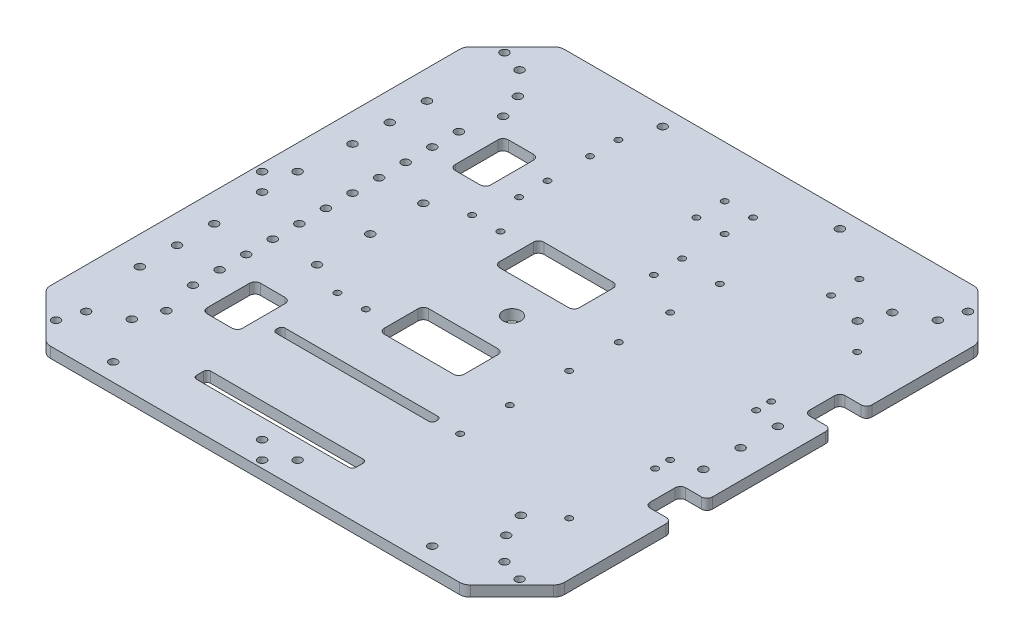
from build123d import *

# Parameters (mm, degrees)
BOSS_EXTRU_1_DEPTH         = 6
ENL_V_MAT_EXTRU_21_REACH   = 214.217
ESQUISSE22_R               = 5
ENL_V_MAT_EXTRU_22_REACH   = 214.217
ESQUISSE23_R               = 2.3
SYM_TRIE15_COPY_1_REACH    = 214.217
SYM_TRIE15_COPY_1_SKETCH_R = 2.3
ENL_V_MAT_EXTRU_23_REACH   = 214.217
CONG_8_R                   = 6
ENL_V_MAT_EXTRU_24_REACH   = 207.149
ESQUISSE27_R               = 2.3
ENL_V_MAT_EXTRU_25_REACH   = 207.149
ESQUISSE28_R               = 2.3
ENL_V_MAT_EXTRU_26_REACH   = 207.149
ESQUISSE29_R               = 2.3
ENL_V_MAT_EXTRU_27_REACH   = 207.149
ESQUISSE30_R               = 2.3
ENL_V_MAT_EXTRU_28_REACH   = 207.149
ESQUISSE32_R               = 2.3
ENL_V_MAT_EXTRU_29_REACH   = 207.149
ESQUISSE33_R               = 2.3
ENL_V_MAT_EXTRU_30_REACH   = 207.149
ESQUISSE39_R               = 2.3
ENL_V_MAT_EXTRU_31_REACH   = 207.149
ESQUISSE38_R               = 1.8
ENL_V_MAT_EXTRU_32_REACH   = 207.149
CONG_9_R                   = 2
ENL_V_MAT_EXTRU_33_REACH   = 207.149
ESQUISSE44_W               = 45
ESQUISSE44_H               = 25
ENL_V_MAT_EXTRU_34_REACH   = 207.149
ESQUISSE45_W               = 15
ESQUISSE45_H               = 20
ENL_V_MAT_EXTRU_35_REACH   = 207.149
ESQUISSE46_R               = 1.8
ENL_V_MAT_EXTRU_36_REACH   = 207.149
ESQUISSE43_R               = 2.3
ENL_V_MAT_EXTRU_37_REACH   = 207.149
ESQUISSE47_W               = 20
ESQUISSE47_H               = 30
CONG_10_R                  = 3


with BuildPart() as part:
    # Esquisse1 → Boss.-Extru.1 (new body)
    with BuildSketch(Plane(origin=(0, 0, 0), x_dir=(1, 0, 0), z_dir=(0, 1, 0))):
        Polygon((-150, 0), (-150, 120), (-120, 150), (0, 150), (120, 150), (150, 120), (150, 0), (150, -120), (120, -150), (0, -150), (-120, -150), (-150, -120), align=None)
    extrude(amount=BOSS_EXTRU_1_DEPTH)

    # Esquisse22 → Enlèv. mat.-Extru.21 (cut, up to next)
    with BuildSketch(Plane(origin=(0, 6, 0), x_dir=(1, 0, 0), z_dir=(0, 1, 0)), mode=Mode.PRIVATE) as enl_v_mat_extru_21_sk1:
        Circle(ESQUISSE22_R)
    enl_v_mat_extru_21_tool1 = extrude(enl_v_mat_extru_21_sk1.sketch, amount=-ENL_V_MAT_EXTRU_21_REACH, mode=Mode.PRIVATE) & part.part
    add(enl_v_mat_extru_21_tool1.solids().sort_by_distance((0, 6, 0))[0], mode=Mode.SUBTRACT)

    # Esquisse23 → Enlèv. mat.-Extru.22 (cut, up to next)
    with BuildSketch(Plane(origin=(0, 6, 0), x_dir=(1, 0, 0), z_dir=(0, 1, 0)), mode=Mode.PRIVATE) as enl_v_mat_extru_22_sk1:
        with Locations((-100, 95)):
            Circle(ESQUISSE23_R)
    enl_v_mat_extru_22_tool1 = extrude(enl_v_mat_extru_22_sk1.sketch, amount=-ENL_V_MAT_EXTRU_22_REACH, mode=Mode.PRIVATE) & part.part
    # Esquisse23 → Enlèv. mat.-Extru.22 (cut, up to next)
    with BuildSketch(Plane(origin=(0, 6, 0), x_dir=(1, 0, 0), z_dir=(0, 1, 0)), mode=Mode.PRIVATE) as enl_v_mat_extru_22_sk2:
        with Locations((-105.619098901, 108.907757819)):
            Circle(ESQUISSE23_R)
    enl_v_mat_extru_22_tool2 = extrude(enl_v_mat_extru_22_sk2.sketch, amount=-ENL_V_MAT_EXTRU_22_REACH, mode=Mode.PRIVATE) & part.part
    enl_v_mat_extru_22_1 = enl_v_mat_extru_22_tool1.solids().sort_by_distance((-100, 6, -95))[0]
    add(enl_v_mat_extru_22_1, mode=Mode.SUBTRACT)
    enl_v_mat_extru_22_2 = enl_v_mat_extru_22_tool2.solids().sort_by_distance((-105.619099, 6, -108.907758))[0]
    add(enl_v_mat_extru_22_2, mode=Mode.SUBTRACT)
    enl_v_mat_extru_22 = enl_v_mat_extru_22_1 + enl_v_mat_extru_22_2  # Enlèv. mat.-Extru.22 as one shape, for the pattern or mirror that repeats it

    # Symétrie14: Enlèv. mat.-Extru.22 across plane
    add(enl_v_mat_extru_22.mirror(Plane(origin=(0, 0, 0), x_dir=(0, 0, 1), z_dir=(1, 0, 0))), mode=Mode.SUBTRACT)

    # Symétrie15: Enlèv. mat.-Extru.22 across plane
    add(enl_v_mat_extru_22.mirror(Plane.XY), mode=Mode.SUBTRACT)

    # Symétrie15 copy 1 sketch → Symétrie15 copy 1 (cut, up to next)
    with BuildSketch(Plane(origin=(0, 6, 0), x_dir=(-1, 0, 0), z_dir=(0, 1, 0)), mode=Mode.PRIVATE) as sym_trie15_copy_1_sk1:
        with Locations((-100, 95)):
            Circle(SYM_TRIE15_COPY_1_SKETCH_R)
    sym_trie15_copy_1_tool1 = extrude(sym_trie15_copy_1_sk1.sketch, amount=-SYM_TRIE15_COPY_1_REACH, mode=Mode.PRIVATE) & part.part
    # Symétrie15 copy 1 sketch → Symétrie15 copy 1 (cut, up to next)
    with BuildSketch(Plane(origin=(0, 6, 0), x_dir=(-1, 0, 0), z_dir=(0, 1, 0)), mode=Mode.PRIVATE) as sym_trie15_copy_1_sk2:
        with Locations((-105.619098901, 108.907757819)):
            Circle(SYM_TRIE15_COPY_1_SKETCH_R)
    sym_trie15_copy_1_tool2 = extrude(sym_trie15_copy_1_sk2.sketch, amount=-SYM_TRIE15_COPY_1_REACH, mode=Mode.PRIVATE) & part.part
    add(sym_trie15_copy_1_tool1.solids().sort_by_distance((100, 6, 95))[0], mode=Mode.SUBTRACT)
    add(sym_trie15_copy_1_tool2.solids().sort_by_distance((105.619099, 6, 108.907758))[0], mode=Mode.SUBTRACT)

    # Esquisse25 → Enlèv. mat.-Extru.23 (cut, up to next)
    with BuildSketch(Plane(origin=(0, 6, 0), x_dir=(1, 0, 0), z_dir=(0, 1, 0)), mode=Mode.PRIVATE) as enl_v_mat_extru_23_sk1:
        Polygon((-150, -120), (-120, -150), (120, -150), (150, -120), (150, 120), (120, 150), (-120, 150), (-150, 120), align=None)
        Polygon((-145, -117.928932188), (-145, 117.928932188), (-117.928932188, 145), (117.928932188, 145), (145, 117.928932188), (145, -117.928932188), (117.928932188, -145), (-117.928932188, -145), align=None, mode=Mode.SUBTRACT)
    enl_v_mat_extru_23_tool1 = extrude(enl_v_mat_extru_23_sk1.sketch, amount=-ENL_V_MAT_EXTRU_23_REACH, mode=Mode.PRIVATE) & part.part
    add(enl_v_mat_extru_23_tool1.solids().sort_by_distance((-132, 6, 132))[0], mode=Mode.SUBTRACT)

    # Congé8
    cong_8_edges = [part.edges().sort_by_distance(p)[0] for p in [
        (-117.928932188, 3, -145),
        (-145, 3, -117.928932188),
        (117.928932188, 3, -145),
        (145, 3, -117.928932188),
        (145, 3, 117.928932188),
        (117.928932188, 3, 145),
        (-145, 3, 117.928932188),
        (-117.928932188, 3, 145),
    ]]
    fillet(cong_8_edges, radius=CONG_8_R)

    # Esquisse27 → Enlèv. mat.-Extru.24 (cut, up to next)
    with BuildSketch(Plane(origin=(0, 6, 0), x_dir=(1, 0, 0), z_dir=(0, 1, 0)), mode=Mode.PRIVATE) as enl_v_mat_extru_24_sk1:
        with Locations((-141, 0)):
            Circle(ESQUISSE27_R)
    enl_v_mat_extru_24_tool1 = extrude(enl_v_mat_extru_24_sk1.sketch, amount=-ENL_V_MAT_EXTRU_24_REACH, mode=Mode.PRIVATE) & part.part
    # Esquisse27 → Enlèv. mat.-Extru.24 (cut, up to next)
    with BuildSketch(Plane(origin=(0, 6, 0), x_dir=(1, 0, 0), z_dir=(0, 1, 0)), mode=Mode.PRIVATE) as enl_v_mat_extru_24_sk2:
        with Locations((-131, 10)):
            Circle(ESQUISSE27_R)
    enl_v_mat_extru_24_tool2 = extrude(enl_v_mat_extru_24_sk2.sketch, amount=-ENL_V_MAT_EXTRU_24_REACH, mode=Mode.PRIVATE) & part.part
    # Esquisse27 → Enlèv. mat.-Extru.24 (cut, up to next)
    with BuildSketch(Plane(origin=(0, 6, 0), x_dir=(1, 0, 0), z_dir=(0, 1, 0)), mode=Mode.PRIVATE) as enl_v_mat_extru_24_sk3:
        with Locations((-131, -10)):
            Circle(ESQUISSE27_R)
    enl_v_mat_extru_24_tool3 = extrude(enl_v_mat_extru_24_sk3.sketch, amount=-ENL_V_MAT_EXTRU_24_REACH, mode=Mode.PRIVATE) & part.part
    add(enl_v_mat_extru_24_tool1.solids().sort_by_distance((-141, 6, 0))[0], mode=Mode.SUBTRACT)
    add(enl_v_mat_extru_24_tool2.solids().sort_by_distance((-131, 6, -10))[0], mode=Mode.SUBTRACT)
    add(enl_v_mat_extru_24_tool3.solids().sort_by_distance((-131, 6, 10))[0], mode=Mode.SUBTRACT)

    # Esquisse28 → Enlèv. mat.-Extru.25 (cut, up to next)
    with BuildSketch(Plane(origin=(0, 6, 0), x_dir=(1, 0, 0), z_dir=(0, 1, 0)), mode=Mode.PRIVATE) as enl_v_mat_extru_25_sk1:
        with Locations((-10, -131)):
            Circle(ESQUISSE28_R)
    enl_v_mat_extru_25_tool1 = extrude(enl_v_mat_extru_25_sk1.sketch, amount=-ENL_V_MAT_EXTRU_25_REACH, mode=Mode.PRIVATE) & part.part
    # Esquisse28 → Enlèv. mat.-Extru.25 (cut, up to next)
    with BuildSketch(Plane(origin=(0, 6, 0), x_dir=(1, 0, 0), z_dir=(0, 1, 0)), mode=Mode.PRIVATE) as enl_v_mat_extru_25_sk2:
        with Locations((10, -131)):
            Circle(ESQUISSE28_R)
    enl_v_mat_extru_25_tool2 = extrude(enl_v_mat_extru_25_sk2.sketch, amount=-ENL_V_MAT_EXTRU_25_REACH, mode=Mode.PRIVATE) & part.part
    # Esquisse28 → Enlèv. mat.-Extru.25 (cut, up to next)
    with BuildSketch(Plane(origin=(0, 6, 0), x_dir=(1, 0, 0), z_dir=(0, 1, 0)), mode=Mode.PRIVATE) as enl_v_mat_extru_25_sk3:
        with Locations((0, -141)):
            Circle(ESQUISSE28_R)
    enl_v_mat_extru_25_tool3 = extrude(enl_v_mat_extru_25_sk3.sketch, amount=-ENL_V_MAT_EXTRU_25_REACH, mode=Mode.PRIVATE) & part.part
    add(enl_v_mat_extru_25_tool1.solids().sort_by_distance((-10, 6, 131))[0], mode=Mode.SUBTRACT)
    add(enl_v_mat_extru_25_tool2.solids().sort_by_distance((10, 6, 131))[0], mode=Mode.SUBTRACT)
    add(enl_v_mat_extru_25_tool3.solids().sort_by_distance((0, 6, 141))[0], mode=Mode.SUBTRACT)

    # Esquisse29 → Enlèv. mat.-Extru.26 (cut, up to next)
    with BuildSketch(Plane(origin=(0, 6, 0), x_dir=(1, 0, 0), z_dir=(0, 1, 0)), mode=Mode.PRIVATE) as enl_v_mat_extru_26_sk1:
        with Locations((126.514718626, 130.757359313)):
            Circle(ESQUISSE29_R)
    enl_v_mat_extru_26_tool1 = extrude(enl_v_mat_extru_26_sk1.sketch, amount=-ENL_V_MAT_EXTRU_26_REACH, mode=Mode.PRIVATE) & part.part
    # Esquisse29 → Enlèv. mat.-Extru.26 (cut, up to next)
    with BuildSketch(Plane(origin=(0, 6, 0), x_dir=(1, 0, 0), z_dir=(0, 1, 0)), mode=Mode.PRIVATE) as enl_v_mat_extru_26_sk2:
        with Locations((-126.514718626, -130.757359313)):
            Circle(ESQUISSE29_R)
    enl_v_mat_extru_26_tool2 = extrude(enl_v_mat_extru_26_sk2.sketch, amount=-ENL_V_MAT_EXTRU_26_REACH, mode=Mode.PRIVATE) & part.part
    # Esquisse29 → Enlèv. mat.-Extru.26 (cut, up to next)
    with BuildSketch(Plane(origin=(0, 6, 0), x_dir=(1, 0, 0), z_dir=(0, 1, 0)), mode=Mode.PRIVATE) as enl_v_mat_extru_26_sk3:
        with Locations((-122.272077939, -118.029437252)):
            Circle(ESQUISSE29_R)
    enl_v_mat_extru_26_tool3 = extrude(enl_v_mat_extru_26_sk3.sketch, amount=-ENL_V_MAT_EXTRU_26_REACH, mode=Mode.PRIVATE) & part.part
    # Esquisse29 → Enlèv. mat.-Extru.26 (cut, up to next)
    with BuildSketch(Plane(origin=(0, 6, 0), x_dir=(1, 0, 0), z_dir=(0, 1, 0)), mode=Mode.PRIVATE) as enl_v_mat_extru_26_sk4:
        with Locations((122.272077939, 118.029437252)):
            Circle(ESQUISSE29_R)
    enl_v_mat_extru_26_tool4 = extrude(enl_v_mat_extru_26_sk4.sketch, amount=-ENL_V_MAT_EXTRU_26_REACH, mode=Mode.PRIVATE) & part.part
    add(enl_v_mat_extru_26_tool1.solids().sort_by_distance((126.514719, 6, -130.757359))[0], mode=Mode.SUBTRACT)
    add(enl_v_mat_extru_26_tool2.solids().sort_by_distance((-126.514719, 6, 130.757359))[0], mode=Mode.SUBTRACT)
    add(enl_v_mat_extru_26_tool3.solids().sort_by_distance((-122.272078, 6, 118.029437))[0], mode=Mode.SUBTRACT)
    add(enl_v_mat_extru_26_tool4.solids().sort_by_distance((122.272078, 6, -118.029437))[0], mode=Mode.SUBTRACT)

    # Esquisse30 → Enlèv. mat.-Extru.27 (cut, up to next)
    with BuildSketch(Plane(origin=(0, 6, 0), x_dir=(1, 0, 0), z_dir=(0, 1, 0)), mode=Mode.PRIVATE) as enl_v_mat_extru_27_sk1:
        with Locations((118.029437252, -122.272077939)):
            Circle(ESQUISSE30_R)
    enl_v_mat_extru_27_tool1 = extrude(enl_v_mat_extru_27_sk1.sketch, amount=-ENL_V_MAT_EXTRU_27_REACH, mode=Mode.PRIVATE) & part.part
    # Esquisse30 → Enlèv. mat.-Extru.27 (cut, up to next)
    with BuildSketch(Plane(origin=(0, 6, 0), x_dir=(1, 0, 0), z_dir=(0, 1, 0)), mode=Mode.PRIVATE) as enl_v_mat_extru_27_sk2:
        with Locations((130.757359313, -126.514718626)):
            Circle(ESQUISSE30_R)
    enl_v_mat_extru_27_tool2 = extrude(enl_v_mat_extru_27_sk2.sketch, amount=-ENL_V_MAT_EXTRU_27_REACH, mode=Mode.PRIVATE) & part.part
    # Esquisse30 → Enlèv. mat.-Extru.27 (cut, up to next)
    with BuildSketch(Plane(origin=(0, 6, 0), x_dir=(1, 0, 0), z_dir=(0, 1, 0)), mode=Mode.PRIVATE) as enl_v_mat_extru_27_sk3:
        with Locations((-118.029437252, 122.272077939)):
            Circle(ESQUISSE30_R)
    enl_v_mat_extru_27_tool3 = extrude(enl_v_mat_extru_27_sk3.sketch, amount=-ENL_V_MAT_EXTRU_27_REACH, mode=Mode.PRIVATE) & part.part
    # Esquisse30 → Enlèv. mat.-Extru.27 (cut, up to next)
    with BuildSketch(Plane(origin=(0, 6, 0), x_dir=(1, 0, 0), z_dir=(0, 1, 0)), mode=Mode.PRIVATE) as enl_v_mat_extru_27_sk4:
        with Locations((-130.757359313, 126.514718626)):
            Circle(ESQUISSE30_R)
    enl_v_mat_extru_27_tool4 = extrude(enl_v_mat_extru_27_sk4.sketch, amount=-ENL_V_MAT_EXTRU_27_REACH, mode=Mode.PRIVATE) & part.part
    add(enl_v_mat_extru_27_tool1.solids().sort_by_distance((118.029437, 6, 122.272078))[0], mode=Mode.SUBTRACT)
    add(enl_v_mat_extru_27_tool2.solids().sort_by_distance((130.757359, 6, 126.514719))[0], mode=Mode.SUBTRACT)
    add(enl_v_mat_extru_27_tool3.solids().sort_by_distance((-118.029437, 6, -122.272078))[0], mode=Mode.SUBTRACT)
    add(enl_v_mat_extru_27_tool4.solids().sort_by_distance((-130.757359, 6, -126.514719))[0], mode=Mode.SUBTRACT)

    # Esquisse32 → Enlèv. mat.-Extru.28 (cut, up to next)
    with BuildSketch(Plane(origin=(0, 6, 0), x_dir=(1, 0, 0), z_dir=(0, 1, 0)), mode=Mode.PRIVATE) as enl_v_mat_extru_28_sk1:
        with Locations((-129, 81)):
            Circle(ESQUISSE32_R)
    enl_v_mat_extru_28_tool1 = extrude(enl_v_mat_extru_28_sk1.sketch, amount=-ENL_V_MAT_EXTRU_28_REACH, mode=Mode.PRIVATE) & part.part
    # Esquisse32 → Enlèv. mat.-Extru.28 (cut, up to next)
    with BuildSketch(Plane(origin=(0, 6, 0), x_dir=(1, 0, 0), z_dir=(0, 1, 0)), mode=Mode.PRIVATE) as enl_v_mat_extru_28_sk2:
        with Locations((-129, 39)):
            Circle(ESQUISSE32_R)
    enl_v_mat_extru_28_tool2 = extrude(enl_v_mat_extru_28_sk2.sketch, amount=-ENL_V_MAT_EXTRU_28_REACH, mode=Mode.PRIVATE) & part.part
    # Esquisse32 → Enlèv. mat.-Extru.28 (cut, up to next)
    with BuildSketch(Plane(origin=(0, 6, 0), x_dir=(1, 0, 0), z_dir=(0, 1, 0)), mode=Mode.PRIVATE) as enl_v_mat_extru_28_sk3:
        with Locations((-129, 60)):
            Circle(ESQUISSE32_R)
    enl_v_mat_extru_28_tool3 = extrude(enl_v_mat_extru_28_sk3.sketch, amount=-ENL_V_MAT_EXTRU_28_REACH, mode=Mode.PRIVATE) & part.part
    enl_v_mat_extru_28_1 = enl_v_mat_extru_28_tool1.solids().sort_by_distance((-129, 6, -81))[0]
    add(enl_v_mat_extru_28_1, mode=Mode.SUBTRACT)
    enl_v_mat_extru_28_2 = enl_v_mat_extru_28_tool2.solids().sort_by_distance((-129, 6, -39))[0]
    add(enl_v_mat_extru_28_2, mode=Mode.SUBTRACT)
    enl_v_mat_extru_28_3 = enl_v_mat_extru_28_tool3.solids().sort_by_distance((-129, 6, -60))[0]
    add(enl_v_mat_extru_28_3, mode=Mode.SUBTRACT)
    enl_v_mat_extru_28 = enl_v_mat_extru_28_1 + enl_v_mat_extru_28_2 + enl_v_mat_extru_28_3  # Enlèv. mat.-Extru.28 as one shape, for the pattern or mirror that repeats it

    # Symétrie16: Enlèv. mat.-Extru.28 across plane
    add(enl_v_mat_extru_28.mirror(Plane.XY), mode=Mode.SUBTRACT)

    # Esquisse33 → Enlèv. mat.-Extru.29 (cut, up to next)
    with BuildSketch(Plane(origin=(0, 6, 0), x_dir=(1, 0, 0), z_dir=(0, 1, 0)), mode=Mode.PRIVATE) as enl_v_mat_extru_29_sk1:
        with Locations((-90, -135)):
            Circle(ESQUISSE33_R)
    enl_v_mat_extru_29_tool1 = extrude(enl_v_mat_extru_29_sk1.sketch, amount=-ENL_V_MAT_EXTRU_29_REACH, mode=Mode.PRIVATE) & part.part
    # Esquisse33 → Enlèv. mat.-Extru.29 (cut, up to next)
    with BuildSketch(Plane(origin=(0, 6, 0), x_dir=(1, 0, 0), z_dir=(0, 1, 0)), mode=Mode.PRIVATE) as enl_v_mat_extru_29_sk2:
        with Locations((90, -135)):
            Circle(ESQUISSE33_R)
    enl_v_mat_extru_29_tool2 = extrude(enl_v_mat_extru_29_sk2.sketch, amount=-ENL_V_MAT_EXTRU_29_REACH, mode=Mode.PRIVATE) & part.part
    # Esquisse33 → Enlèv. mat.-Extru.29 (cut, up to next)
    with BuildSketch(Plane(origin=(0, 6, 0), x_dir=(1, 0, 0), z_dir=(0, 1, 0)), mode=Mode.PRIVATE) as enl_v_mat_extru_29_sk3:
        with Locations((50, 135)):
            Circle(ESQUISSE33_R)
    enl_v_mat_extru_29_tool3 = extrude(enl_v_mat_extru_29_sk3.sketch, amount=-ENL_V_MAT_EXTRU_29_REACH, mode=Mode.PRIVATE) & part.part
    # Esquisse33 → Enlèv. mat.-Extru.29 (cut, up to next)
    with BuildSketch(Plane(origin=(0, 6, 0), x_dir=(1, 0, 0), z_dir=(0, 1, 0)), mode=Mode.PRIVATE) as enl_v_mat_extru_29_sk4:
        with Locations((-50, 135)):
            Circle(ESQUISSE33_R)
    enl_v_mat_extru_29_tool4 = extrude(enl_v_mat_extru_29_sk4.sketch, amount=-ENL_V_MAT_EXTRU_29_REACH, mode=Mode.PRIVATE) & part.part
    add(enl_v_mat_extru_29_tool1.solids().sort_by_distance((-90, 6, 135))[0], mode=Mode.SUBTRACT)
    add(enl_v_mat_extru_29_tool2.solids().sort_by_distance((90, 6, 135))[0], mode=Mode.SUBTRACT)
    add(enl_v_mat_extru_29_tool3.solids().sort_by_distance((50, 6, -135))[0], mode=Mode.SUBTRACT)
    add(enl_v_mat_extru_29_tool4.solids().sort_by_distance((-50, 6, -135))[0], mode=Mode.SUBTRACT)

    # Esquisse39 → Enlèv. mat.-Extru.30 (cut, up to next)
    with BuildSketch(Plane(origin=(0, 6, 0), x_dir=(1, 0, 0), z_dir=(0, 1, 0)), mode=Mode.PRIVATE) as enl_v_mat_extru_30_sk1:
        with Locations((129, 0)):
            Circle(ESQUISSE39_R)
    enl_v_mat_extru_30_tool1 = extrude(enl_v_mat_extru_30_sk1.sketch, amount=-ENL_V_MAT_EXTRU_30_REACH, mode=Mode.PRIVATE) & part.part
    # Esquisse39 → Enlèv. mat.-Extru.30 (cut, up to next)
    with BuildSketch(Plane(origin=(0, 6, 0), x_dir=(1, 0, 0), z_dir=(0, 1, 0)), mode=Mode.PRIVATE) as enl_v_mat_extru_30_sk2:
        with Locations((129, 21)):
            Circle(ESQUISSE39_R)
    enl_v_mat_extru_30_tool2 = extrude(enl_v_mat_extru_30_sk2.sketch, amount=-ENL_V_MAT_EXTRU_30_REACH, mode=Mode.PRIVATE) & part.part
    # Esquisse39 → Enlèv. mat.-Extru.30 (cut, up to next)
    with BuildSketch(Plane(origin=(0, 6, 0), x_dir=(1, 0, 0), z_dir=(0, 1, 0)), mode=Mode.PRIVATE) as enl_v_mat_extru_30_sk3:
        with Locations((129, -21)):
            Circle(ESQUISSE39_R)
    enl_v_mat_extru_30_tool3 = extrude(enl_v_mat_extru_30_sk3.sketch, amount=-ENL_V_MAT_EXTRU_30_REACH, mode=Mode.PRIVATE) & part.part
    add(enl_v_mat_extru_30_tool1.solids().sort_by_distance((129, 6, 0))[0], mode=Mode.SUBTRACT)
    add(enl_v_mat_extru_30_tool2.solids().sort_by_distance((129, 6, -21))[0], mode=Mode.SUBTRACT)
    add(enl_v_mat_extru_30_tool3.solids().sort_by_distance((129, 6, 21))[0], mode=Mode.SUBTRACT)

    # Esquisse38 → Enlèv. mat.-Extru.31 (cut, up to next)
    with BuildSketch(Plane(origin=(0, 6, 0), x_dir=(1, 0, 0), z_dir=(0, 1, 0)), mode=Mode.PRIVATE) as enl_v_mat_extru_31_sk1:
        with Locations((115, -34.25)):
            Circle(ESQUISSE38_R)
    enl_v_mat_extru_31_tool1 = extrude(enl_v_mat_extru_31_sk1.sketch, amount=-ENL_V_MAT_EXTRU_31_REACH, mode=Mode.PRIVATE) & part.part
    # Esquisse38 → Enlèv. mat.-Extru.31 (cut, up to next)
    with BuildSketch(Plane(origin=(0, 6, 0), x_dir=(1, 0, 0), z_dir=(0, 1, 0)), mode=Mode.PRIVATE) as enl_v_mat_extru_31_sk2:
        with Locations((115, -25.75)):
            Circle(ESQUISSE38_R)
    enl_v_mat_extru_31_tool2 = extrude(enl_v_mat_extru_31_sk2.sketch, amount=-ENL_V_MAT_EXTRU_31_REACH, mode=Mode.PRIVATE) & part.part
    # Esquisse38 → Enlèv. mat.-Extru.31 (cut, up to next)
    with BuildSketch(Plane(origin=(0, 6, 0), x_dir=(1, 0, 0), z_dir=(0, 1, 0)), mode=Mode.PRIVATE) as enl_v_mat_extru_31_sk3:
        with Locations((115, -82.75)):
            Circle(ESQUISSE38_R)
    enl_v_mat_extru_31_tool3 = extrude(enl_v_mat_extru_31_sk3.sketch, amount=-ENL_V_MAT_EXTRU_31_REACH, mode=Mode.PRIVATE) & part.part
    # Esquisse38 → Enlèv. mat.-Extru.31 (cut, up to next)
    with BuildSketch(Plane(origin=(0, 6, 0), x_dir=(1, 0, 0), z_dir=(0, 1, 0)), mode=Mode.PRIVATE) as enl_v_mat_extru_31_sk4:
        with Locations((43, -44.25)):
            Circle(ESQUISSE38_R)
    enl_v_mat_extru_31_tool4 = extrude(enl_v_mat_extru_31_sk4.sketch, amount=-ENL_V_MAT_EXTRU_31_REACH, mode=Mode.PRIVATE) & part.part
    # Esquisse38 → Enlèv. mat.-Extru.31 (cut, up to next)
    with BuildSketch(Plane(origin=(0, 6, 0), x_dir=(1, 0, 0), z_dir=(0, 1, 0)), mode=Mode.PRIVATE) as enl_v_mat_extru_31_sk5:
        with Locations((43, -72.25)):
            Circle(ESQUISSE38_R)
    enl_v_mat_extru_31_tool5 = extrude(enl_v_mat_extru_31_sk5.sketch, amount=-ENL_V_MAT_EXTRU_31_REACH, mode=Mode.PRIVATE) & part.part
    # Esquisse38 → Enlèv. mat.-Extru.31 (cut, up to next)
    with BuildSketch(Plane(origin=(0, 6, 0), x_dir=(1, 0, 0), z_dir=(0, 1, 0)), mode=Mode.PRIVATE) as enl_v_mat_extru_31_sk6:
        with Locations((115, 22.75)):
            Circle(ESQUISSE38_R)
    enl_v_mat_extru_31_tool6 = extrude(enl_v_mat_extru_31_sk6.sketch, amount=-ENL_V_MAT_EXTRU_31_REACH, mode=Mode.PRIVATE) & part.part
    # Esquisse38 → Enlèv. mat.-Extru.31 (cut, up to next)
    with BuildSketch(Plane(origin=(0, 6, 0), x_dir=(1, 0, 0), z_dir=(0, 1, 0)), mode=Mode.PRIVATE) as enl_v_mat_extru_31_sk7:
        with Locations((115, 31.25)):
            Circle(ESQUISSE38_R)
    enl_v_mat_extru_31_tool7 = extrude(enl_v_mat_extru_31_sk7.sketch, amount=-ENL_V_MAT_EXTRU_31_REACH, mode=Mode.PRIVATE) & part.part
    # Esquisse38 → Enlèv. mat.-Extru.31 (cut, up to next)
    with BuildSketch(Plane(origin=(0, 6, 0), x_dir=(1, 0, 0), z_dir=(0, 1, 0)), mode=Mode.PRIVATE) as enl_v_mat_extru_31_sk8:
        with Locations((115, 79.75)):
            Circle(ESQUISSE38_R)
    enl_v_mat_extru_31_tool8 = extrude(enl_v_mat_extru_31_sk8.sketch, amount=-ENL_V_MAT_EXTRU_31_REACH, mode=Mode.PRIVATE) & part.part
    # Esquisse38 → Enlèv. mat.-Extru.31 (cut, up to next)
    with BuildSketch(Plane(origin=(0, 6, 0), x_dir=(1, 0, 0), z_dir=(0, 1, 0)), mode=Mode.PRIVATE) as enl_v_mat_extru_31_sk9:
        with Locations((43, 46.25)):
            Circle(ESQUISSE38_R)
    enl_v_mat_extru_31_tool9 = extrude(enl_v_mat_extru_31_sk9.sketch, amount=-ENL_V_MAT_EXTRU_31_REACH, mode=Mode.PRIVATE) & part.part
    # Esquisse38 → Enlèv. mat.-Extru.31 (cut, up to next)
    with BuildSketch(Plane(origin=(0, 6, 0), x_dir=(1, 0, 0), z_dir=(0, 1, 0)), mode=Mode.PRIVATE) as enl_v_mat_extru_31_sk10:
        with Locations((43, 74.25)):
            Circle(ESQUISSE38_R)
    enl_v_mat_extru_31_tool10 = extrude(enl_v_mat_extru_31_sk10.sketch, amount=-ENL_V_MAT_EXTRU_31_REACH, mode=Mode.PRIVATE) & part.part
    # Esquisse38 → Enlèv. mat.-Extru.31 (cut, up to next)
    with BuildSketch(Plane(origin=(0, 6, 0), x_dir=(1, 0, 0), z_dir=(0, 1, 0)), mode=Mode.PRIVATE) as enl_v_mat_extru_31_sk11:
        with Locations((43, -10.75)):
            Circle(ESQUISSE38_R)
    enl_v_mat_extru_31_tool11 = extrude(enl_v_mat_extru_31_sk11.sketch, amount=-ENL_V_MAT_EXTRU_31_REACH, mode=Mode.PRIVATE) & part.part
    # Esquisse38 → Enlèv. mat.-Extru.31 (cut, up to next)
    with BuildSketch(Plane(origin=(0, 6, 0), x_dir=(1, 0, 0), z_dir=(0, 1, 0)), mode=Mode.PRIVATE) as enl_v_mat_extru_31_sk12:
        with Locations((43, 17.25)):
            Circle(ESQUISSE38_R)
    enl_v_mat_extru_31_tool12 = extrude(enl_v_mat_extru_31_sk12.sketch, amount=-ENL_V_MAT_EXTRU_31_REACH, mode=Mode.PRIVATE) & part.part
    add(enl_v_mat_extru_31_tool1.solids().sort_by_distance((115, 6, 34.25))[0], mode=Mode.SUBTRACT)
    add(enl_v_mat_extru_31_tool2.solids().sort_by_distance((115, 6, 25.75))[0], mode=Mode.SUBTRACT)
    add(enl_v_mat_extru_31_tool3.solids().sort_by_distance((115, 6, 82.75))[0], mode=Mode.SUBTRACT)
    add(enl_v_mat_extru_31_tool4.solids().sort_by_distance((43, 6, 44.25))[0], mode=Mode.SUBTRACT)
    add(enl_v_mat_extru_31_tool5.solids().sort_by_distance((43, 6, 72.25))[0], mode=Mode.SUBTRACT)
    add(enl_v_mat_extru_31_tool6.solids().sort_by_distance((115, 6, -22.75))[0], mode=Mode.SUBTRACT)
    add(enl_v_mat_extru_31_tool7.solids().sort_by_distance((115, 6, -31.25))[0], mode=Mode.SUBTRACT)
    add(enl_v_mat_extru_31_tool8.solids().sort_by_distance((115, 6, -79.75))[0], mode=Mode.SUBTRACT)
    add(enl_v_mat_extru_31_tool9.solids().sort_by_distance((43, 6, -46.25))[0], mode=Mode.SUBTRACT)
    add(enl_v_mat_extru_31_tool10.solids().sort_by_distance((43, 6, -74.25))[0], mode=Mode.SUBTRACT)
    add(enl_v_mat_extru_31_tool11.solids().sort_by_distance((43, 6, 10.75))[0], mode=Mode.SUBTRACT)
    add(enl_v_mat_extru_31_tool12.solids().sort_by_distance((43, 6, -17.25))[0], mode=Mode.SUBTRACT)

    # Esquisse40 → Enlèv. mat.-Extru.32 (cut, up to next)
    with BuildSketch(Plane(origin=(0, 6, 0), x_dir=(1, 0, 0), z_dir=(0, 1, 0)), mode=Mode.PRIVATE) as enl_v_mat_extru_32_sk1:
        Polygon((0, -120), (30, -120), (30, -112), (0, -112), (-60, -112), (-60, -120), align=None)
    enl_v_mat_extru_32_tool1 = extrude(enl_v_mat_extru_32_sk1.sketch, amount=-ENL_V_MAT_EXTRU_32_REACH, mode=Mode.PRIVATE) & part.part
    # Esquisse40 → Enlèv. mat.-Extru.32 (cut, up to next)
    with BuildSketch(Plane(origin=(0, 6, 0), x_dir=(1, 0, 0), z_dir=(0, 1, 0)), mode=Mode.PRIVATE) as enl_v_mat_extru_32_sk2:
        Polygon((-60, -75), (-60, -70), (30, -70), (30, -75), (0, -75), align=None)
    enl_v_mat_extru_32_tool2 = extrude(enl_v_mat_extru_32_sk2.sketch, amount=-ENL_V_MAT_EXTRU_32_REACH, mode=Mode.PRIVATE) & part.part
    add(enl_v_mat_extru_32_tool1.solids().sort_by_distance((-15, 6, 116))[0], mode=Mode.SUBTRACT)
    add(enl_v_mat_extru_32_tool2.solids().sort_by_distance((-15, 6, 72.5))[0], mode=Mode.SUBTRACT)

    # Congé9
    cong_9_edges = [part.edges().sort_by_distance(p)[0] for p in [
        (-60, 3, 120),
        (-60, 3, 112),
        (30, 3, 112),
        (30, 3, 120),
        (30, 3, 75),
        (30, 3, 70),
        (-60, 3, 75),
        (-60, 3, 70),
    ]]
    fillet(cong_9_edges, radius=CONG_9_R)

    # Esquisse44 → Enlèv. mat.-Extru.33 (cut, up to next)
    with BuildSketch(Plane(origin=(0, 6, 0), x_dir=(1, 0, 0), z_dir=(0, 1, 0)), mode=Mode.PRIVATE) as enl_v_mat_extru_33_sk1:
        with Locations((-7.5, -32.5)):
            Rectangle(ESQUISSE44_W, ESQUISSE44_H)
    enl_v_mat_extru_33_tool1 = extrude(enl_v_mat_extru_33_sk1.sketch, amount=-ENL_V_MAT_EXTRU_33_REACH, mode=Mode.PRIVATE) & part.part
    # Esquisse44 → Enlèv. mat.-Extru.33 (cut, up to next)
    with BuildSketch(Plane(origin=(0, 6, 0), x_dir=(1, 0, 0), z_dir=(0, 1, 0)), mode=Mode.PRIVATE) as enl_v_mat_extru_33_sk2:
        with Locations((-7.5, 32.5)):
            Rectangle(ESQUISSE44_W, ESQUISSE44_H)
    enl_v_mat_extru_33_tool2 = extrude(enl_v_mat_extru_33_sk2.sketch, amount=-ENL_V_MAT_EXTRU_33_REACH, mode=Mode.PRIVATE) & part.part
    add(enl_v_mat_extru_33_tool1.solids().sort_by_distance((-7.5, 6, 32.5))[0], mode=Mode.SUBTRACT)
    add(enl_v_mat_extru_33_tool2.solids().sort_by_distance((-7.5, 6, -32.5))[0], mode=Mode.SUBTRACT)

    # Esquisse45 → Enlèv. mat.-Extru.34 (cut, up to next)
    with BuildSketch(Plane(origin=(0, 6, 0), x_dir=(1, 0, 0), z_dir=(0, 1, 0)), mode=Mode.PRIVATE) as enl_v_mat_extru_34_sk1:
        with Locations((137.5, 45)):
            Rectangle(ESQUISSE45_W, ESQUISSE45_H)
    enl_v_mat_extru_34_tool1 = extrude(enl_v_mat_extru_34_sk1.sketch, amount=-ENL_V_MAT_EXTRU_34_REACH, mode=Mode.PRIVATE) & part.part
    # Esquisse45 → Enlèv. mat.-Extru.34 (cut, up to next)
    with BuildSketch(Plane(origin=(0, 6, 0), x_dir=(1, 0, 0), z_dir=(0, 1, 0)), mode=Mode.PRIVATE) as enl_v_mat_extru_34_sk2:
        with Locations((137.5, -45)):
            Rectangle(ESQUISSE45_W, ESQUISSE45_H)
    enl_v_mat_extru_34_tool2 = extrude(enl_v_mat_extru_34_sk2.sketch, amount=-ENL_V_MAT_EXTRU_34_REACH, mode=Mode.PRIVATE) & part.part
    add(enl_v_mat_extru_34_tool1.solids().sort_by_distance((137.5, 6, -45))[0], mode=Mode.SUBTRACT)
    add(enl_v_mat_extru_34_tool2.solids().sort_by_distance((137.5, 6, 45))[0], mode=Mode.SUBTRACT)

    # Esquisse46 → Enlèv. mat.-Extru.35 (cut, up to next)
    with BuildSketch(Plane(origin=(0, 6, 0), x_dir=(1, 0, 0), z_dir=(0, 1, 0)), mode=Mode.PRIVATE) as enl_v_mat_extru_35_sk1:
        with Locations((-44.5, -38)):
            Circle(ESQUISSE46_R)
    enl_v_mat_extru_35_tool1 = extrude(enl_v_mat_extru_35_sk1.sketch, amount=-ENL_V_MAT_EXTRU_35_REACH, mode=Mode.PRIVATE) & part.part
    # Esquisse46 → Enlèv. mat.-Extru.35 (cut, up to next)
    with BuildSketch(Plane(origin=(0, 6, 0), x_dir=(1, 0, 0), z_dir=(0, 1, 0)), mode=Mode.PRIVATE) as enl_v_mat_extru_35_sk2:
        with Locations((-60.5, -38)):
            Circle(ESQUISSE46_R)
    enl_v_mat_extru_35_tool2 = extrude(enl_v_mat_extru_35_sk2.sketch, amount=-ENL_V_MAT_EXTRU_35_REACH, mode=Mode.PRIVATE) & part.part
    # Esquisse46 → Enlèv. mat.-Extru.35 (cut, up to next)
    with BuildSketch(Plane(origin=(0, 6, 0), x_dir=(1, 0, 0), z_dir=(0, 1, 0)), mode=Mode.PRIVATE) as enl_v_mat_extru_35_sk3:
        with Locations((-60.5, 38)):
            Circle(ESQUISSE46_R)
    enl_v_mat_extru_35_tool3 = extrude(enl_v_mat_extru_35_sk3.sketch, amount=-ENL_V_MAT_EXTRU_35_REACH, mode=Mode.PRIVATE) & part.part
    # Esquisse46 → Enlèv. mat.-Extru.35 (cut, up to next)
    with BuildSketch(Plane(origin=(0, 6, 0), x_dir=(1, 0, 0), z_dir=(0, 1, 0)), mode=Mode.PRIVATE) as enl_v_mat_extru_35_sk4:
        with Locations((-44.5, 38)):
            Circle(ESQUISSE46_R)
    enl_v_mat_extru_35_tool4 = extrude(enl_v_mat_extru_35_sk4.sketch, amount=-ENL_V_MAT_EXTRU_35_REACH, mode=Mode.PRIVATE) & part.part
    # Esquisse46 → Enlèv. mat.-Extru.35 (cut, up to next)
    with BuildSketch(Plane(origin=(0, 6, 0), x_dir=(1, 0, 0), z_dir=(0, 1, 0)), mode=Mode.PRIVATE) as enl_v_mat_extru_35_sk5:
        with Locations((-56, 60)):
            Circle(ESQUISSE46_R)
    enl_v_mat_extru_35_tool5 = extrude(enl_v_mat_extru_35_sk5.sketch, amount=-ENL_V_MAT_EXTRU_35_REACH, mode=Mode.PRIVATE) & part.part
    # Esquisse46 → Enlèv. mat.-Extru.35 (cut, up to next)
    with BuildSketch(Plane(origin=(0, 6, 0), x_dir=(1, 0, 0), z_dir=(0, 1, 0)), mode=Mode.PRIVATE) as enl_v_mat_extru_35_sk6:
        with Locations((-56, 76)):
            Circle(ESQUISSE46_R)
    enl_v_mat_extru_35_tool6 = extrude(enl_v_mat_extru_35_sk6.sketch, amount=-ENL_V_MAT_EXTRU_35_REACH, mode=Mode.PRIVATE) & part.part
    # Esquisse46 → Enlèv. mat.-Extru.35 (cut, up to next)
    with BuildSketch(Plane(origin=(0, 6, 0), x_dir=(1, 0, 0), z_dir=(0, 1, 0)), mode=Mode.PRIVATE) as enl_v_mat_extru_35_sk7:
        with Locations((20, 76)):
            Circle(ESQUISSE46_R)
    enl_v_mat_extru_35_tool7 = extrude(enl_v_mat_extru_35_sk7.sketch, amount=-ENL_V_MAT_EXTRU_35_REACH, mode=Mode.PRIVATE) & part.part
    # Esquisse46 → Enlèv. mat.-Extru.35 (cut, up to next)
    with BuildSketch(Plane(origin=(0, 6, 0), x_dir=(1, 0, 0), z_dir=(0, 1, 0)), mode=Mode.PRIVATE) as enl_v_mat_extru_35_sk8:
        with Locations((20, 60)):
            Circle(ESQUISSE46_R)
    enl_v_mat_extru_35_tool8 = extrude(enl_v_mat_extru_35_sk8.sketch, amount=-ENL_V_MAT_EXTRU_35_REACH, mode=Mode.PRIVATE) & part.part
    # Esquisse46 → Enlèv. mat.-Extru.35 (cut, up to next)
    with BuildSketch(Plane(origin=(0, 6, 0), x_dir=(1, 0, 0), z_dir=(0, 1, 0)), mode=Mode.PRIVATE) as enl_v_mat_extru_35_sk9:
        with Locations((-56, 100)):
            Circle(ESQUISSE46_R)
    enl_v_mat_extru_35_tool9 = extrude(enl_v_mat_extru_35_sk9.sketch, amount=-ENL_V_MAT_EXTRU_35_REACH, mode=Mode.PRIVATE) & part.part
    # Esquisse46 → Enlèv. mat.-Extru.35 (cut, up to next)
    with BuildSketch(Plane(origin=(0, 6, 0), x_dir=(1, 0, 0), z_dir=(0, 1, 0)), mode=Mode.PRIVATE) as enl_v_mat_extru_35_sk10:
        with Locations((-56, 116)):
            Circle(ESQUISSE46_R)
    enl_v_mat_extru_35_tool10 = extrude(enl_v_mat_extru_35_sk10.sketch, amount=-ENL_V_MAT_EXTRU_35_REACH, mode=Mode.PRIVATE) & part.part
    # Esquisse46 → Enlèv. mat.-Extru.35 (cut, up to next)
    with BuildSketch(Plane(origin=(0, 6, 0), x_dir=(1, 0, 0), z_dir=(0, 1, 0)), mode=Mode.PRIVATE) as enl_v_mat_extru_35_sk11:
        with Locations((20, 116)):
            Circle(ESQUISSE46_R)
    enl_v_mat_extru_35_tool11 = extrude(enl_v_mat_extru_35_sk11.sketch, amount=-ENL_V_MAT_EXTRU_35_REACH, mode=Mode.PRIVATE) & part.part
    # Esquisse46 → Enlèv. mat.-Extru.35 (cut, up to next)
    with BuildSketch(Plane(origin=(0, 6, 0), x_dir=(1, 0, 0), z_dir=(0, 1, 0)), mode=Mode.PRIVATE) as enl_v_mat_extru_35_sk12:
        with Locations((20, 100)):
            Circle(ESQUISSE46_R)
    enl_v_mat_extru_35_tool12 = extrude(enl_v_mat_extru_35_sk12.sketch, amount=-ENL_V_MAT_EXTRU_35_REACH, mode=Mode.PRIVATE) & part.part
    # Esquisse46 → Enlèv. mat.-Extru.35 (cut, up to next)
    with BuildSketch(Plane(origin=(0, 6, 0), x_dir=(1, 0, 0), z_dir=(0, 1, 0)), mode=Mode.PRIVATE) as enl_v_mat_extru_35_sk13:
        with Locations((4, 100)):
            Circle(ESQUISSE46_R)
    enl_v_mat_extru_35_tool13 = extrude(enl_v_mat_extru_35_sk13.sketch, amount=-ENL_V_MAT_EXTRU_35_REACH, mode=Mode.PRIVATE) & part.part
    # Esquisse46 → Enlèv. mat.-Extru.35 (cut, up to next)
    with BuildSketch(Plane(origin=(0, 6, 0), x_dir=(1, 0, 0), z_dir=(0, 1, 0)), mode=Mode.PRIVATE) as enl_v_mat_extru_35_sk14:
        with Locations((4, 116)):
            Circle(ESQUISSE46_R)
    enl_v_mat_extru_35_tool14 = extrude(enl_v_mat_extru_35_sk14.sketch, amount=-ENL_V_MAT_EXTRU_35_REACH, mode=Mode.PRIVATE) & part.part
    # Esquisse46 → Enlèv. mat.-Extru.35 (cut, up to next)
    with BuildSketch(Plane(origin=(0, 6, 0), x_dir=(1, 0, 0), z_dir=(0, 1, 0)), mode=Mode.PRIVATE) as enl_v_mat_extru_35_sk15:
        with Locations((80, 116)):
            Circle(ESQUISSE46_R)
    enl_v_mat_extru_35_tool15 = extrude(enl_v_mat_extru_35_sk15.sketch, amount=-ENL_V_MAT_EXTRU_35_REACH, mode=Mode.PRIVATE) & part.part
    # Esquisse46 → Enlèv. mat.-Extru.35 (cut, up to next)
    with BuildSketch(Plane(origin=(0, 6, 0), x_dir=(1, 0, 0), z_dir=(0, 1, 0)), mode=Mode.PRIVATE) as enl_v_mat_extru_35_sk16:
        with Locations((80, 100)):
            Circle(ESQUISSE46_R)
    enl_v_mat_extru_35_tool16 = extrude(enl_v_mat_extru_35_sk16.sketch, amount=-ENL_V_MAT_EXTRU_35_REACH, mode=Mode.PRIVATE) & part.part
    add(enl_v_mat_extru_35_tool1.solids().sort_by_distance((-44.5, 6, 38))[0], mode=Mode.SUBTRACT)
    add(enl_v_mat_extru_35_tool2.solids().sort_by_distance((-60.5, 6, 38))[0], mode=Mode.SUBTRACT)
    add(enl_v_mat_extru_35_tool3.solids().sort_by_distance((-60.5, 6, -38))[0], mode=Mode.SUBTRACT)
    add(enl_v_mat_extru_35_tool4.solids().sort_by_distance((-44.5, 6, -38))[0], mode=Mode.SUBTRACT)
    add(enl_v_mat_extru_35_tool5.solids().sort_by_distance((-56, 6, -60))[0], mode=Mode.SUBTRACT)
    add(enl_v_mat_extru_35_tool6.solids().sort_by_distance((-56, 6, -76))[0], mode=Mode.SUBTRACT)
    add(enl_v_mat_extru_35_tool7.solids().sort_by_distance((20, 6, -76))[0], mode=Mode.SUBTRACT)
    add(enl_v_mat_extru_35_tool8.solids().sort_by_distance((20, 6, -60))[0], mode=Mode.SUBTRACT)
    add(enl_v_mat_extru_35_tool9.solids().sort_by_distance((-56, 6, -100))[0], mode=Mode.SUBTRACT)
    add(enl_v_mat_extru_35_tool10.solids().sort_by_distance((-56, 6, -116))[0], mode=Mode.SUBTRACT)
    add(enl_v_mat_extru_35_tool11.solids().sort_by_distance((20, 6, -116))[0], mode=Mode.SUBTRACT)
    add(enl_v_mat_extru_35_tool12.solids().sort_by_distance((20, 6, -100))[0], mode=Mode.SUBTRACT)
    add(enl_v_mat_extru_35_tool13.solids().sort_by_distance((4, 6, -100))[0], mode=Mode.SUBTRACT)
    add(enl_v_mat_extru_35_tool14.solids().sort_by_distance((4, 6, -116))[0], mode=Mode.SUBTRACT)
    add(enl_v_mat_extru_35_tool15.solids().sort_by_distance((80, 6, -116))[0], mode=Mode.SUBTRACT)
    add(enl_v_mat_extru_35_tool16.solids().sort_by_distance((80, 6, -100))[0], mode=Mode.SUBTRACT)

    # Esquisse43 → Enlèv. mat.-Extru.36 (cut, up to next)
    with BuildSketch(Plane(origin=(0, 6, 0), x_dir=(1, 0, 0), z_dir=(0, 1, 0)), mode=Mode.PRIVATE) as enl_v_mat_extru_36_sk1:
        with Locations((-105, -15)):
            Circle(ESQUISSE43_R)
    enl_v_mat_extru_36_tool1 = extrude(enl_v_mat_extru_36_sk1.sketch, amount=-ENL_V_MAT_EXTRU_36_REACH, mode=Mode.PRIVATE) & part.part
    # Esquisse43 → Enlèv. mat.-Extru.36 (cut, up to next)
    with BuildSketch(Plane(origin=(0, 6, 0), x_dir=(1, 0, 0), z_dir=(0, 1, 0)), mode=Mode.PRIVATE) as enl_v_mat_extru_36_sk2:
        with Locations((-105, -30)):
            Circle(ESQUISSE43_R)
    enl_v_mat_extru_36_tool2 = extrude(enl_v_mat_extru_36_sk2.sketch, amount=-ENL_V_MAT_EXTRU_36_REACH, mode=Mode.PRIVATE) & part.part
    # Esquisse43 → Enlèv. mat.-Extru.36 (cut, up to next)
    with BuildSketch(Plane(origin=(0, 6, 0), x_dir=(1, 0, 0), z_dir=(0, 1, 0)), mode=Mode.PRIVATE) as enl_v_mat_extru_36_sk3:
        with Locations((-105, -45)):
            Circle(ESQUISSE43_R)
    enl_v_mat_extru_36_tool3 = extrude(enl_v_mat_extru_36_sk3.sketch, amount=-ENL_V_MAT_EXTRU_36_REACH, mode=Mode.PRIVATE) & part.part
    # Esquisse43 → Enlèv. mat.-Extru.36 (cut, up to next)
    with BuildSketch(Plane(origin=(0, 6, 0), x_dir=(1, 0, 0), z_dir=(0, 1, 0)), mode=Mode.PRIVATE) as enl_v_mat_extru_36_sk4:
        with Locations((-105, -60)):
            Circle(ESQUISSE43_R)
    enl_v_mat_extru_36_tool4 = extrude(enl_v_mat_extru_36_sk4.sketch, amount=-ENL_V_MAT_EXTRU_36_REACH, mode=Mode.PRIVATE) & part.part
    # Esquisse43 → Enlèv. mat.-Extru.36 (cut, up to next)
    with BuildSketch(Plane(origin=(0, 6, 0), x_dir=(1, 0, 0), z_dir=(0, 1, 0)), mode=Mode.PRIVATE) as enl_v_mat_extru_36_sk5:
        with Locations((-105, -75)):
            Circle(ESQUISSE43_R)
    enl_v_mat_extru_36_tool5 = extrude(enl_v_mat_extru_36_sk5.sketch, amount=-ENL_V_MAT_EXTRU_36_REACH, mode=Mode.PRIVATE) & part.part
    # Esquisse43 → Enlèv. mat.-Extru.36 (cut, up to next)
    with BuildSketch(Plane(origin=(0, 6, 0), x_dir=(1, 0, 0), z_dir=(0, 1, 0)), mode=Mode.PRIVATE) as enl_v_mat_extru_36_sk6:
        with Locations((-105, 0)):
            Circle(ESQUISSE43_R)
    enl_v_mat_extru_36_tool6 = extrude(enl_v_mat_extru_36_sk6.sketch, amount=-ENL_V_MAT_EXTRU_36_REACH, mode=Mode.PRIVATE) & part.part
    # Esquisse43 → Enlèv. mat.-Extru.36 (cut, up to next)
    with BuildSketch(Plane(origin=(0, 6, 0), x_dir=(1, 0, 0), z_dir=(0, 1, 0)), mode=Mode.PRIVATE) as enl_v_mat_extru_36_sk7:
        with Locations((-105, 15)):
            Circle(ESQUISSE43_R)
    enl_v_mat_extru_36_tool7 = extrude(enl_v_mat_extru_36_sk7.sketch, amount=-ENL_V_MAT_EXTRU_36_REACH, mode=Mode.PRIVATE) & part.part
    # Esquisse43 → Enlèv. mat.-Extru.36 (cut, up to next)
    with BuildSketch(Plane(origin=(0, 6, 0), x_dir=(1, 0, 0), z_dir=(0, 1, 0)), mode=Mode.PRIVATE) as enl_v_mat_extru_36_sk8:
        with Locations((-105, 30)):
            Circle(ESQUISSE43_R)
    enl_v_mat_extru_36_tool8 = extrude(enl_v_mat_extru_36_sk8.sketch, amount=-ENL_V_MAT_EXTRU_36_REACH, mode=Mode.PRIVATE) & part.part
    # Esquisse43 → Enlèv. mat.-Extru.36 (cut, up to next)
    with BuildSketch(Plane(origin=(0, 6, 0), x_dir=(1, 0, 0), z_dir=(0, 1, 0)), mode=Mode.PRIVATE) as enl_v_mat_extru_36_sk9:
        with Locations((-105, 45)):
            Circle(ESQUISSE43_R)
    enl_v_mat_extru_36_tool9 = extrude(enl_v_mat_extru_36_sk9.sketch, amount=-ENL_V_MAT_EXTRU_36_REACH, mode=Mode.PRIVATE) & part.part
    # Esquisse43 → Enlèv. mat.-Extru.36 (cut, up to next)
    with BuildSketch(Plane(origin=(0, 6, 0), x_dir=(1, 0, 0), z_dir=(0, 1, 0)), mode=Mode.PRIVATE) as enl_v_mat_extru_36_sk10:
        with Locations((-105, 60)):
            Circle(ESQUISSE43_R)
    enl_v_mat_extru_36_tool10 = extrude(enl_v_mat_extru_36_sk10.sketch, amount=-ENL_V_MAT_EXTRU_36_REACH, mode=Mode.PRIVATE) & part.part
    # Esquisse43 → Enlèv. mat.-Extru.36 (cut, up to next)
    with BuildSketch(Plane(origin=(0, 6, 0), x_dir=(1, 0, 0), z_dir=(0, 1, 0)), mode=Mode.PRIVATE) as enl_v_mat_extru_36_sk11:
        with Locations((-105, 75)):
            Circle(ESQUISSE43_R)
    enl_v_mat_extru_36_tool11 = extrude(enl_v_mat_extru_36_sk11.sketch, amount=-ENL_V_MAT_EXTRU_36_REACH, mode=Mode.PRIVATE) & part.part
    # Esquisse43 → Enlèv. mat.-Extru.36 (cut, up to next)
    with BuildSketch(Plane(origin=(0, 6, 0), x_dir=(1, 0, 0), z_dir=(0, 1, 0)), mode=Mode.PRIVATE) as enl_v_mat_extru_36_sk12:
        with Locations((-80, 0)):
            Circle(ESQUISSE43_R)
    enl_v_mat_extru_36_tool12 = extrude(enl_v_mat_extru_36_sk12.sketch, amount=-ENL_V_MAT_EXTRU_36_REACH, mode=Mode.PRIVATE) & part.part
    # Esquisse43 → Enlèv. mat.-Extru.36 (cut, up to next)
    with BuildSketch(Plane(origin=(0, 6, 0), x_dir=(1, 0, 0), z_dir=(0, 1, 0)), mode=Mode.PRIVATE) as enl_v_mat_extru_36_sk13:
        with Locations((-80, 30)):
            Circle(ESQUISSE43_R)
    enl_v_mat_extru_36_tool13 = extrude(enl_v_mat_extru_36_sk13.sketch, amount=-ENL_V_MAT_EXTRU_36_REACH, mode=Mode.PRIVATE) & part.part
    # Esquisse43 → Enlèv. mat.-Extru.36 (cut, up to next)
    with BuildSketch(Plane(origin=(0, 6, 0), x_dir=(1, 0, 0), z_dir=(0, 1, 0)), mode=Mode.PRIVATE) as enl_v_mat_extru_36_sk14:
        with Locations((-80, -30)):
            Circle(ESQUISSE43_R)
    enl_v_mat_extru_36_tool14 = extrude(enl_v_mat_extru_36_sk14.sketch, amount=-ENL_V_MAT_EXTRU_36_REACH, mode=Mode.PRIVATE) & part.part
    add(enl_v_mat_extru_36_tool1.solids().sort_by_distance((-105, 6, 15))[0], mode=Mode.SUBTRACT)
    add(enl_v_mat_extru_36_tool2.solids().sort_by_distance((-105, 6, 30))[0], mode=Mode.SUBTRACT)
    add(enl_v_mat_extru_36_tool3.solids().sort_by_distance((-105, 6, 45))[0], mode=Mode.SUBTRACT)
    add(enl_v_mat_extru_36_tool4.solids().sort_by_distance((-105, 6, 60))[0], mode=Mode.SUBTRACT)
    add(enl_v_mat_extru_36_tool5.solids().sort_by_distance((-105, 6, 75))[0], mode=Mode.SUBTRACT)
    add(enl_v_mat_extru_36_tool6.solids().sort_by_distance((-105, 6, 0))[0], mode=Mode.SUBTRACT)
    add(enl_v_mat_extru_36_tool7.solids().sort_by_distance((-105, 6, -15))[0], mode=Mode.SUBTRACT)
    add(enl_v_mat_extru_36_tool8.solids().sort_by_distance((-105, 6, -30))[0], mode=Mode.SUBTRACT)
    add(enl_v_mat_extru_36_tool9.solids().sort_by_distance((-105, 6, -45))[0], mode=Mode.SUBTRACT)
    add(enl_v_mat_extru_36_tool10.solids().sort_by_distance((-105, 6, -60))[0], mode=Mode.SUBTRACT)
    add(enl_v_mat_extru_36_tool11.solids().sort_by_distance((-105, 6, -75))[0], mode=Mode.SUBTRACT)
    add(enl_v_mat_extru_36_tool12.solids().sort_by_distance((-80, 6, 0))[0], mode=Mode.SUBTRACT)
    add(enl_v_mat_extru_36_tool13.solids().sort_by_distance((-80, 6, -30))[0], mode=Mode.SUBTRACT)
    add(enl_v_mat_extru_36_tool14.solids().sort_by_distance((-80, 6, 30))[0], mode=Mode.SUBTRACT)

    # Esquisse47 → Enlèv. mat.-Extru.37 (cut, up to next)
    with BuildSketch(Plane(origin=(0, 6, 0), x_dir=(1, 0, 0), z_dir=(0, 1, 0)), mode=Mode.PRIVATE) as enl_v_mat_extru_37_sk1:
        with Locations((-80, -70)):
            Rectangle(ESQUISSE47_W, ESQUISSE47_H)
    enl_v_mat_extru_37_tool1 = extrude(enl_v_mat_extru_37_sk1.sketch, amount=-ENL_V_MAT_EXTRU_37_REACH, mode=Mode.PRIVATE) & part.part
    # Esquisse47 → Enlèv. mat.-Extru.37 (cut, up to next)
    with BuildSketch(Plane(origin=(0, 6, 0), x_dir=(1, 0, 0), z_dir=(0, 1, 0)), mode=Mode.PRIVATE) as enl_v_mat_extru_37_sk2:
        with Locations((-80, 70)):
            Rectangle(ESQUISSE47_W, ESQUISSE47_H)
    enl_v_mat_extru_37_tool2 = extrude(enl_v_mat_extru_37_sk2.sketch, amount=-ENL_V_MAT_EXTRU_37_REACH, mode=Mode.PRIVATE) & part.part
    add(enl_v_mat_extru_37_tool1.solids().sort_by_distance((-80, 6, 70))[0], mode=Mode.SUBTRACT)
    add(enl_v_mat_extru_37_tool2.solids().sort_by_distance((-80, 6, -70))[0], mode=Mode.SUBTRACT)

    # Congé10
    cong_10_edges = [part.edges().sort_by_distance(p)[0] for p in [
        (130, 3, 55),
        (145, 3, 55),
        (130, 3, 35),
        (145, 3, 35),
        (145, 3, -35),
        (130, 3, -35),
        (130, 3, -55),
        (145, 3, -55),
        (-30, 3, -45),
        (-30, 3, -20),
        (15, 3, -20),
        (15, 3, -45),
        (15, 3, 45),
        (15, 3, 20),
        (-30, 3, 20),
        (-30, 3, 45),
        (-90, 3, -85),
        (-90, 3, -55),
        (-70, 3, -55),
        (-70, 3, -85),
        (-70, 3, 55),
        (-70, 3, 85),
        (-90, 3, 85),
        (-90, 3, 55),
    ]]
    fillet(cong_10_edges, radius=CONG_10_R)


solid = part.part
